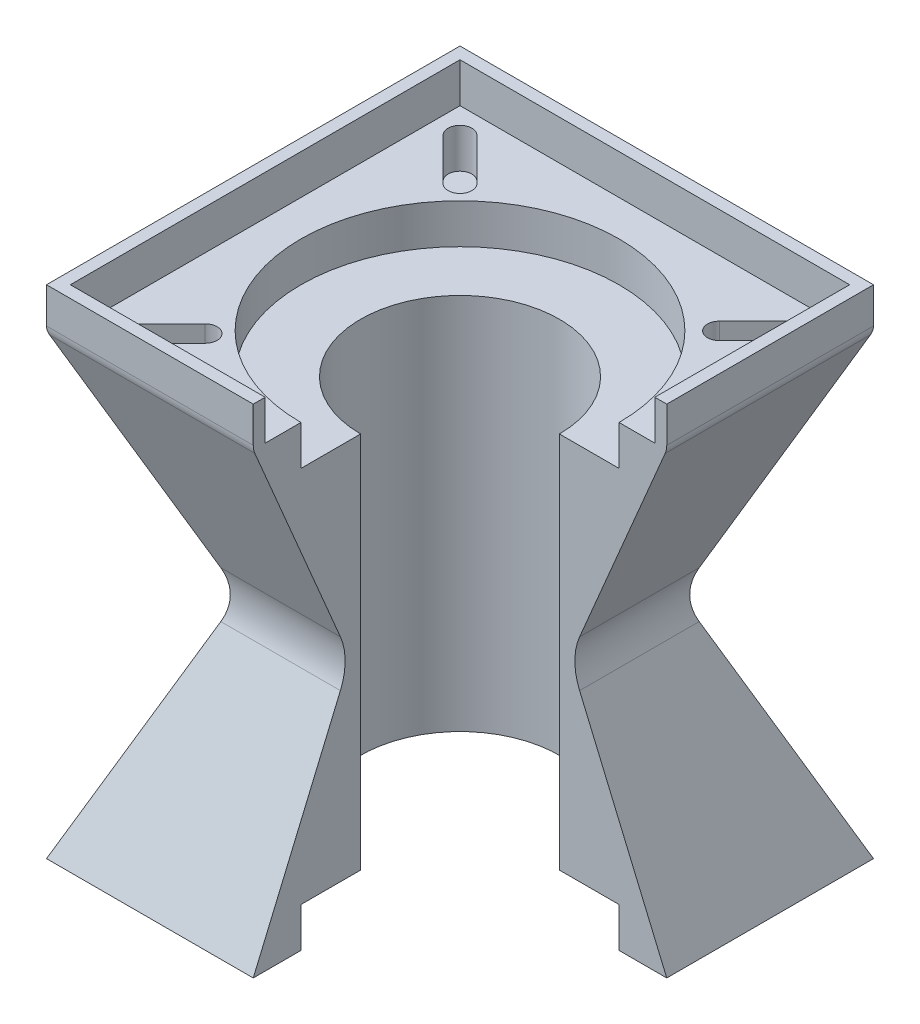
from build123d import *

# Parameters (mm, degrees)
SKETCH1_W           = 104
SKETCH1_H           = 115
BOSS_EXTRUDE1_DEPTH = 104
CUT_EXTRUDE1_DEPTH  = 187.70029459
CUT_EXTRUDE2_DEPTH  = 187.70029459
SKETCH4_R           = 25
CUT_EXTRUDE3_DEPTH  = 187.70029459
SKETCH5_R           = 40
CUT_EXTRUDE4_DEPTH  = 10
CUT_EXTRUDE5_START  = -10
SKETCH6_R           = 40
CUT_EXTRUDE5_DEPTH  = 10
FILLET1_R           = 15
SKETCH8_W           = 104
SKETCH8_H           = 104
SKETCH8_W_2         = 98
SKETCH8_H_2         = 98
BOSS_EXTRUDE2_DEPTH = 10
FILLET2_R           = 5
CUT_EXTRUDE6_DEPTH  = 10
SKETCH12_W          = 52
SKETCH12_H          = 52
CUT_EXTRUDE8_DEPTH  = 187.70029459
CUT_EXTRUDE9_DEPTH  = 194.020724276
SKETCH15_W          = 52.000105155
SKETCH15_H          = 10
CUT_EXTRUDE12_DEPTH = 194.020497647


with BuildPart() as part:
    # Sketch1 → Boss-Extrude1 (new body)
    with BuildSketch(Plane.XY):
        with Locations((52, 57.5)):
            Rectangle(SKETCH1_W, SKETCH1_H)
    extrude(amount=BOSS_EXTRUDE1_DEPTH)

    # Sketch2 → Cut-Extrude1 (cut, through all)
    with BuildSketch(Plane(origin=(104, 0, 0), x_dir=(0, 0, -1), z_dir=(1, 0, 0))):
        Polygon((-104, 115), (-79.592698068, 57.5), (-104, 0), align=None)
        Polygon((0, 115), (-24.407301932, 57.5), (0, 0), align=None)
    extrude(amount=-CUT_EXTRUDE1_DEPTH, mode=Mode.SUBTRACT)

    # Sketch3 → Cut-Extrude2 (cut, through all)
    with BuildSketch(Plane.XY):
        Polygon((0, 115), (24.407301932, 57.5), (0, 0), align=None)
        Polygon((104, 115), (79.592698068, 57.5), (104, 0), align=None)
    extrude(amount=CUT_EXTRUDE2_DEPTH, mode=Mode.SUBTRACT)

    # Sketch4 → Cut-Extrude3 (cut, through all)
    with BuildSketch(Plane(origin=(0, 115, 0), x_dir=(1, 0, 0), z_dir=(0, 1, 0))):
        with Locations(Location((52, -52, 0), (0, 0, 270))):
            Circle(SKETCH4_R)
    extrude(amount=-CUT_EXTRUDE3_DEPTH, mode=Mode.SUBTRACT)

    # Sketch5 → Cut-Extrude4 (cut)
    with BuildSketch(Plane(origin=(0, 115, 0), x_dir=(1, 0, 0), z_dir=(0, 1, 0))):
        with Locations(Location((52, -52, 0), (0, 0, 270))):
            Circle(SKETCH5_R)
    extrude(amount=-CUT_EXTRUDE4_DEPTH, mode=Mode.SUBTRACT)

    # Sketch6 → Cut-Extrude5 (cut)
    with BuildSketch(Plane.XZ.offset(CUT_EXTRUDE5_START)):
        with Locations(Location((52, 52, 0), (0, 0, 90))):
            Circle(SKETCH6_R)
    extrude(amount=CUT_EXTRUDE5_DEPTH, mode=Mode.SUBTRACT)

    # Fillet1
    fillet1_edges = [part.edges().sort_by_distance(p)[0] for p in [
        (52, 57.5, 79.592698068),
        (52, 57.5, 24.407301932),
        (24.407301932, 57.5, 52),
        (79.592698068, 57.5, 52),
    ]]
    fillet(fillet1_edges, radius=FILLET1_R)

    # Sketch8 → Boss-Extrude2 (add)
    with BuildSketch(Plane(origin=(0, 115, 0), x_dir=(1, 0, 0), z_dir=(0, 1, 0))):
        with Locations((52, -52)):
            Rectangle(SKETCH8_W, SKETCH8_H)
        with Locations((52, -52)):
            Rectangle(SKETCH8_W_2, SKETCH8_H_2, mode=Mode.SUBTRACT)
    extrude(amount=BOSS_EXTRUDE2_DEPTH)

    # Fillet2
    fillet2_edges = [part.edges().sort_by_distance(p)[0] for p in [
        (52, 115, 104),
        (52, 115, 0),
        (0, 115, 52),
        (104, 115, 52),
    ]]
    fillet(fillet2_edges, radius=FILLET2_R)

    # Sketch11 → Cut-Extrude6 (cut)
    with BuildSketch(Plane(origin=(0, 115, 0), x_dir=(1, 0, 0), z_dir=(0, 1, 0))):
        with BuildLine():
            Line((97.40784106, -10.935563022), (86.801239342, -21.54216474))
            ThreePointArc((86.801239342, -21.54216474), (82.558598655, -21.54216474), (82.558598655, -17.299524053))
            Line((82.558598655, -17.299524053), (93.165200373, -6.692922335))
            ThreePointArc((93.165200373, -6.692922335), (97.40784106, -6.692922335), (97.40784106, -10.935563022))
        make_face()
        with BuildLine():
            Line((11.514167897, -7.27152721), (22.120769615, -17.878128928))
            ThreePointArc((22.120769615, -17.878128928), (22.120769615, -22.120769615), (17.878128928, -22.120769615))
            Line((17.878128928, -22.120769615), (7.27152721, -11.514167897))
            ThreePointArc((7.27152721, -11.514167897), (7.27152721, -7.27152721), (11.514167897, -7.27152721))
        make_face()
        with BuildLine():
            Line((93.743805248, -96.829236185), (83.13720353, -86.222634468))
            ThreePointArc((83.13720353, -86.222634468), (83.13720353, -81.97999378), (87.379844217, -81.97999378))
            Line((87.379844217, -81.97999378), (97.986445935, -92.586595498))
            ThreePointArc((97.986445935, -92.586595498), (97.986445935, -96.829236185), (93.743805248, -96.829236185))
        make_face()
        with BuildLine():
            Line((7.850132085, -93.165200373), (18.456733803, -82.558598655))
            ThreePointArc((18.456733803, -82.558598655), (22.69937449, -82.558598655), (22.69937449, -86.801239342))
            Line((22.69937449, -86.801239342), (12.092772772, -97.40784106))
            ThreePointArc((12.092772772, -97.40784106), (7.850132085, -97.40784106), (7.850132085, -93.165200373))
        make_face()
    extrude(amount=-CUT_EXTRUDE6_DEPTH, mode=Mode.SUBTRACT)

    # Sketch12 → Cut-Extrude8 (cut, through all)
    with BuildSketch(Plane(origin=(0, 115, 0), x_dir=(1, 0, 0), z_dir=(0, 1, 0))):
        with Locations((78, -78)):
            Rectangle(SKETCH12_W, SKETCH12_H)
    extrude(amount=-CUT_EXTRUDE8_DEPTH, mode=Mode.SUBTRACT)

    # Sketch13 → Cut-Extrude9 (cut, through all)
    with BuildSketch(Plane(origin=(0, 125, 0), x_dir=(1, 0, 0), z_dir=(0, 1, 0))):
        Polygon((101, -52), (104, -52), (104, -104), (52, -103.895424297), (52, -101), (101, -101), align=None)
    extrude(amount=-CUT_EXTRUDE9_DEPTH, mode=Mode.SUBTRACT)

    # Sketch15 → Cut-Extrude12 (cut, through all)
    with BuildSketch(Plane(origin=(-0.208729944, 0, 103.790428823), x_dir=(-0.9999979778024204, 0, -0.002011067147068195), z_dir=(0.002011067147068195, 0, -0.9999979778024204))):
        with Locations((-78.208888098, 120)):
            Rectangle(SKETCH15_W, SKETCH15_H)
    extrude(amount=-CUT_EXTRUDE12_DEPTH, mode=Mode.SUBTRACT)


solid = part.part
